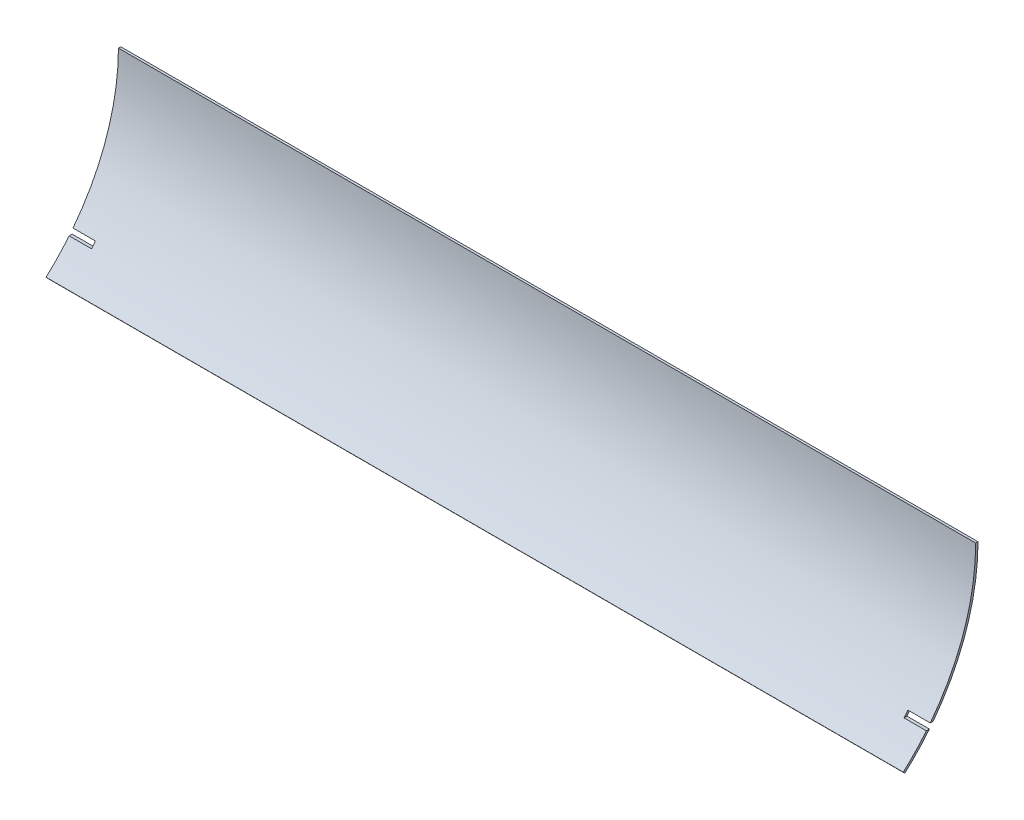
from build123d import *

# Parameters (mm, degrees)
EXTRUDE_THIN1_DEPTH = 584.2
SKETCH3_W           = 15.24
SKETCH3_H           = 3.302
CUT_EXTRUDE1_DEPTH  = 614.413196966


with BuildPart() as part:
    # Sketch2 → Extrude-Thin1 (new body)
    with BuildSketch(Plane(origin=(0, 0, 0), x_dir=(0, 0, -1), z_dir=(1, 0, 0))):
        with BuildLine():
            ThreePointArc((100.125623552, -111.716090426), (136.978732363, -61.175585258), (150.01875, 0))
            Line((150.01875, 0), (148.43125, 0))
            ThreePointArc((148.43125, 0), (135.529221968, -60.528224568), (99.066093144, -110.533909574))
            Line((99.066093144, -110.533909574), (100.125623552, -111.716090426))
        make_face()
    extrude(amount=EXTRUDE_THIN1_DEPTH)

    # Sketch3 → Cut-Extrude1 (cut, through all)
    with BuildSketch(Plane.XY):
        with Locations((7.62, -92.372909574)):
            Rectangle(SKETCH3_W, SKETCH3_H)
        with Locations((576.58, -92.372909574)):
            Rectangle(SKETCH3_W, SKETCH3_H)
    extrude(amount=-CUT_EXTRUDE1_DEPTH, mode=Mode.SUBTRACT)


solid = part.part
